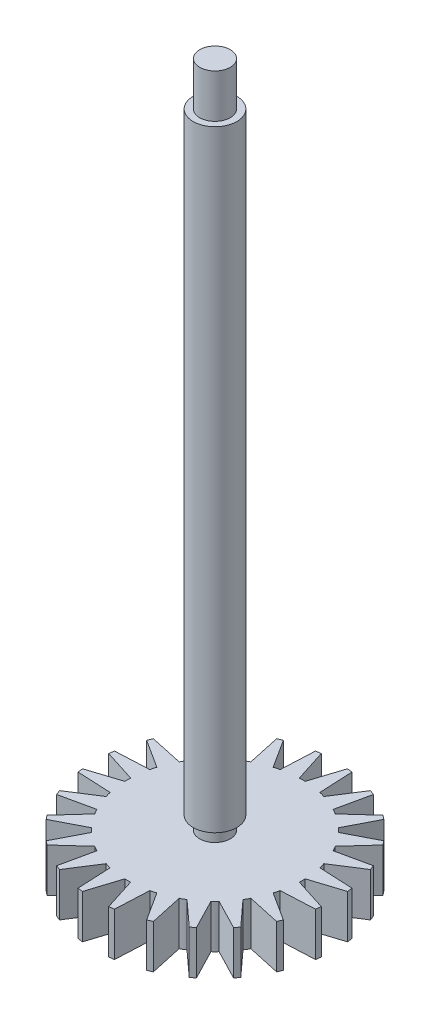
from build123d import *

# Parameters (mm, degrees)
SKETCH1_R                 = 5
CENTERSCREW_DEPTH         = 140
SKETCH2_R                 = 3.5
TEETHWHEELCONNECTOR_DEPTH = 17
INNERHOLE_D               = 4
INNERHOLE_DEPTH           = 10
INNERHOLE_TIP             = 1.201721238
SKETCH5_R                 = 27.5
BOSS_EXTRUDE3_DEPTH       = 5
CUT_EXTRUDE5_DEPTH        = 5
CIRPATTERN1_COUNT         = 24
BOSS_EXTRUDE4_START       = 10
SKETCH10_R                = 3.5
BOSS_EXTRUDE4_DEPTH       = 10


with BuildPart() as part:
    # Sketch1 → centerScrew (new body)
    with BuildSketch(Plane(origin=(0, 0, 0), x_dir=(1, 0, 0), z_dir=(0, 1, 0))):
        with Locations(Location((0, 0, 0), (0, 0, 270))):
            Circle(SKETCH1_R)
    extrude(amount=CENTERSCREW_DEPTH)

    # Sketch2 → teethWheelConnector (add)
    with BuildSketch(Plane.XZ):
        with Locations(Location((0, 0, 0), (0, 0, 270))):
            Circle(SKETCH2_R)
    extrude(amount=TEETHWHEELCONNECTOR_DEPTH)

    # innerHole
    with Locations(Plane(origin=(0, -17, 0), x_dir=(-1, 0, 0), z_dir=(0, -1, 0))):
        with Locations((0, 0)):
            Hole(INNERHOLE_D / 2, depth=INNERHOLE_DEPTH)
            with Locations((0, 0, -(INNERHOLE_DEPTH + INNERHOLE_TIP / 2))):  # 118° drill point
                Cone(0, INNERHOLE_D / 2, INNERHOLE_TIP, mode=Mode.SUBTRACT)

    # Sketch5 → Boss-Extrude3 (add, symmetric)
    with BuildSketch(Plane(origin=(0, -8, 0), x_dir=(-1, 0, 0), z_dir=(0, -1, 0))):
        with Locations(Location((0, 0, 0), (0, 0, 90))):
            Circle(SKETCH5_R)
    extrude(amount=BOSS_EXTRUDE3_DEPTH, both=True)

    # Sketch9 → Cut-Extrude5 (cut, symmetric)
    with BuildSketch(Plane(origin=(0, -8, 0), x_dir=(-1, 0, 0), z_dir=(0, -1, 0))):
        with BuildLine():
            Line((4.013866942, 30.488346334), (0.652630961, 19.957224307))
            ThreePointArc((0.652630961, 19.957224307), (0, 20), (-0.652630961, 19.957224307))
            Line((-0.652630961, 19.957224307), (-4.013866942, 30.488346334))
            ThreePointArc((-4.013866942, 30.488346334), (0, 31), (4.013866942, 30.488346334))
        make_face()
    cut_extrude5 = extrude(amount=CUT_EXTRUDE5_DEPTH, both=True, mode=Mode.SUBTRACT)

    # CirPattern1: Cut-Extrude5 ×24 about axis
    cirpattern1_axis = Axis((0, 0, 0), (0, 1, 0))
    for i in range(1, CIRPATTERN1_COUNT):
        add(cut_extrude5.rotate(cirpattern1_axis, i * 360 / CIRPATTERN1_COUNT), mode=Mode.SUBTRACT)

    # Sketch10 → Boss-Extrude4 (add)
    with BuildSketch(Plane(origin=(0, 140, 0), x_dir=(1, 0, 0), z_dir=(0, 1, 0)).offset(BOSS_EXTRUDE4_START)):
        with Locations(Location((0, 0, 0), (0, 0, 90))):
            Circle(SKETCH10_R)
    extrude(amount=-BOSS_EXTRUDE4_DEPTH)


solid = part.part
